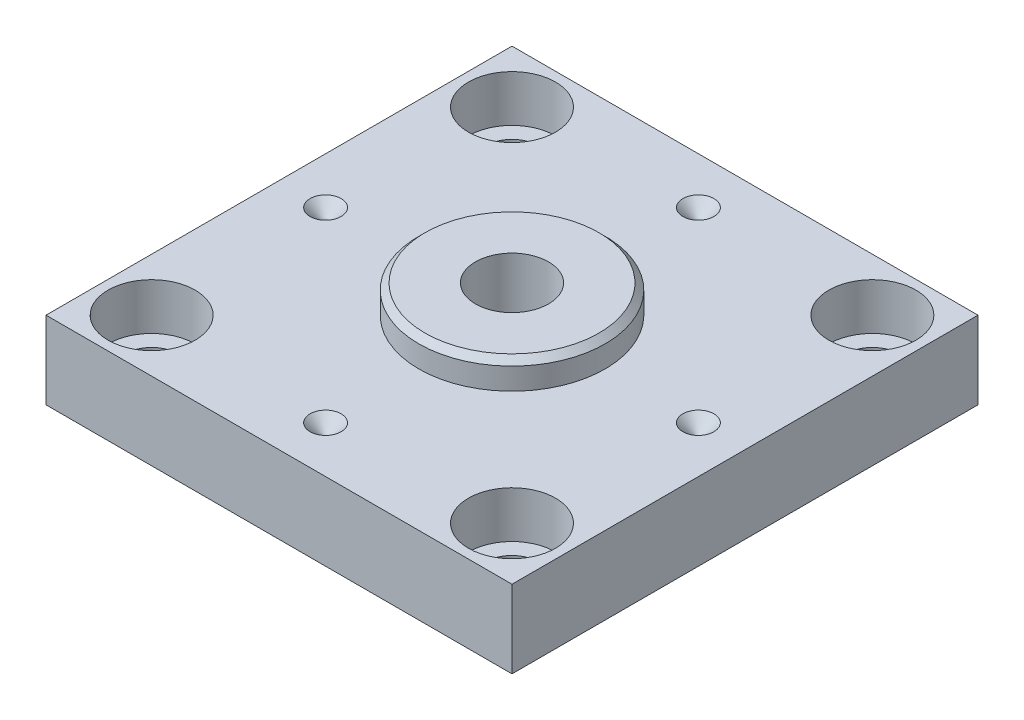
from build123d import *

# Parameters (mm, degrees)
SKETCH1_W              = 150
SKETCH1_H              = 150
BOSS_EXTRUDE1_DEPTH    = 25
SKETCH2_R              = 30
BOSS_EXTRUDE2_DEPTH    = 9
CHAMFER1_SIZE          = 2
M25X1_5_TAPPED_HOLE1_D = 23.5
HOLE1_D                = 17
HOLE1_CBORE_D          = 28
HOLE1_CBORE_DEPTH      = 15
CIRPATTERN1_COUNT      = 4


with BuildPart() as part:
    # Sketch1 → Boss-Extrude1 (new body)
    with BuildSketch(Plane(origin=(0, 0, 0), x_dir=(1, 0, 0), z_dir=(0, 1, 0))):
        Rectangle(SKETCH1_W, SKETCH1_H)
    extrude(amount=BOSS_EXTRUDE1_DEPTH)

    # Sketch2 → Boss-Extrude2 (add)
    with BuildSketch(Plane(origin=(0, 25, 0), x_dir=(1, 0, 0), z_dir=(0, 1, 0))):
        with Locations(Location((0, 0, 0), (0, 0, 270))):
            Circle(SKETCH2_R)
    extrude(amount=BOSS_EXTRUDE2_DEPTH)

    # Chamfer1
    chamfer1_edges = [part.edges().sort_by_distance(p)[0] for p in [
        (0, 34, -30),
    ]]
    chamfer(chamfer1_edges, length=CHAMFER1_SIZE)

    # M25x1.5 Tapped Hole1 (through all)
    with Locations(Plane(origin=(0, 34, 0), x_dir=(1, 0, 0), z_dir=(0, 1, 0))):
        with Locations((0, 0)):
            Hole(M25X1_5_TAPPED_HOLE1_D / 2)

    # Hole1 (through all)
    with Locations(Plane(origin=(0, 25, 0), x_dir=(1, 0, 0), z_dir=(0, 1, 0))):
        with Locations((-58, 58), (58, 58), (-58, -58), (58, -58)):
            CounterBoreHole(HOLE1_D / 2, HOLE1_CBORE_D / 2, HOLE1_CBORE_DEPTH)

    # Sketch7 → Cut-Revolve1 (revolve, cut)
    with BuildSketch(Plane.XY, mode=Mode.PRIVATE) as cut_revolve1_sk:
        Polygon((-65, 25), (-60, 20), (-60, 25), align=None)
    cut_revolve1 = revolve(cut_revolve1_sk.sketch.rotate(Axis((-60, 28.226297144, 0), (0, -1, 0)), 270), axis=Axis((-60, 28.226297144, 0), (0, -1, 0)), mode=Mode.SUBTRACT)

    # CirPattern1: Cut-Revolve1 ×4 about axis
    cirpattern1_axis = Axis((0, 0, 0), (0, 1, 0))
    for i in range(1, CIRPATTERN1_COUNT):
        add(cut_revolve1.rotate(cirpattern1_axis, i * 360 / CIRPATTERN1_COUNT), mode=Mode.SUBTRACT)


solid = part.part
